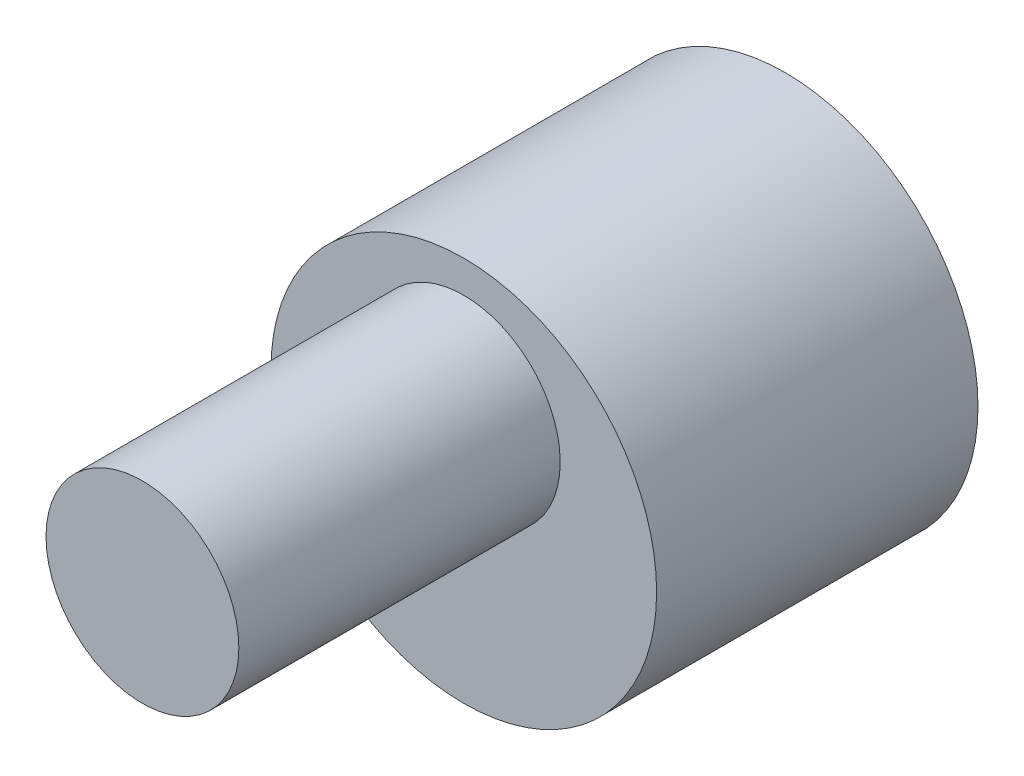
from build123d import *

# Parameters (mm, degrees)
ESQUISSE1_R        = 6
BOSS_EXTRU_1_DEPTH = 10
ESQUISSE2_R        = 3
BOSS_EXTRU_2_DEPTH = 10


with BuildPart() as part:
    # Esquisse1 → Boss.-Extru.1 (new body)
    with BuildSketch(Plane.XY):
        Circle(ESQUISSE1_R)
    extrude(amount=BOSS_EXTRU_1_DEPTH)

    # Esquisse2 → Boss.-Extru.2 (add)
    with BuildSketch(Plane.XY.offset(10)):
        with Locations((0, 2)):
            Circle(ESQUISSE2_R)
    extrude(amount=BOSS_EXTRU_2_DEPTH)


solid = part.part
